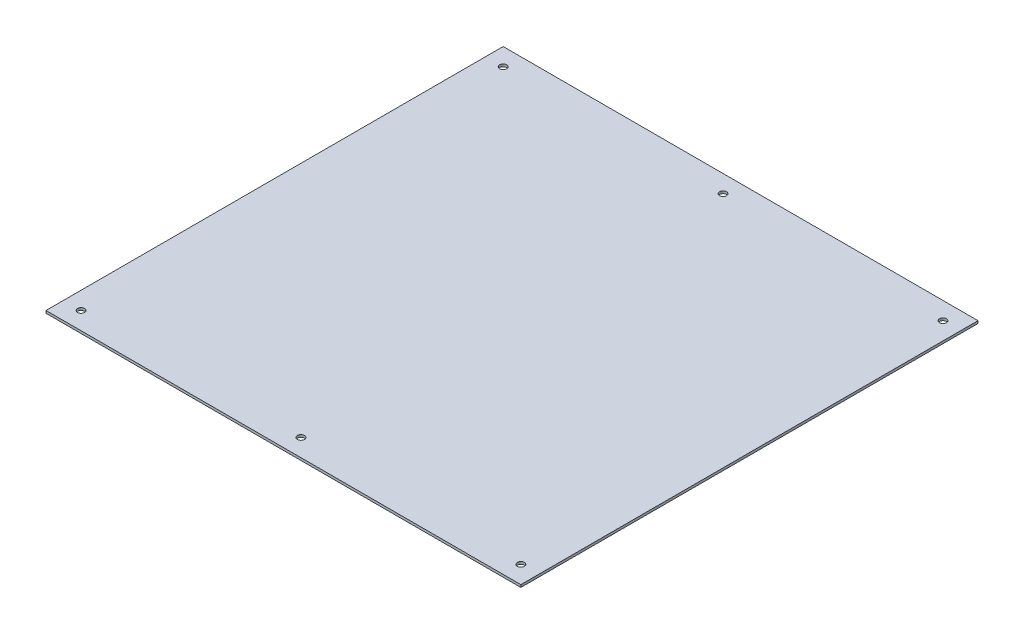
from build123d import *

# Parameters (mm, degrees)
SKETCH1_W                = 609.6
SKETCH1_H                = 586.899999934
BOSS_EXTRUDE1_DEPTH      = 3.175
F_5_16_CLEARANCE_HOLE4_D = 9.000000034


with BuildPart() as part:
    # Sketch1 → Boss-Extrude1 (new body)
    with BuildSketch(Plane(origin=(0, 0, 0), x_dir=(1, 0, 0), z_dir=(0, 1, 0))):
        Rectangle(SKETCH1_W, SKETCH1_H)
    extrude(amount=BOSS_EXTRUDE1_DEPTH)

    # 5/16 Clearance Hole4 (through all)
    with Locations(Plane(origin=(0, 3.175, 0), x_dir=(1, 0, 0), z_dir=(0, 1, 0))):
        with Locations((-282.3, 270.949999967), (0, 270.949999967), (282.3, 270.949999967), (282.3, -270.949999967), (0, -270.949999967), (-282.3, -270.949999967)):
            Hole(F_5_16_CLEARANCE_HOLE4_D / 2)


solid = part.part
